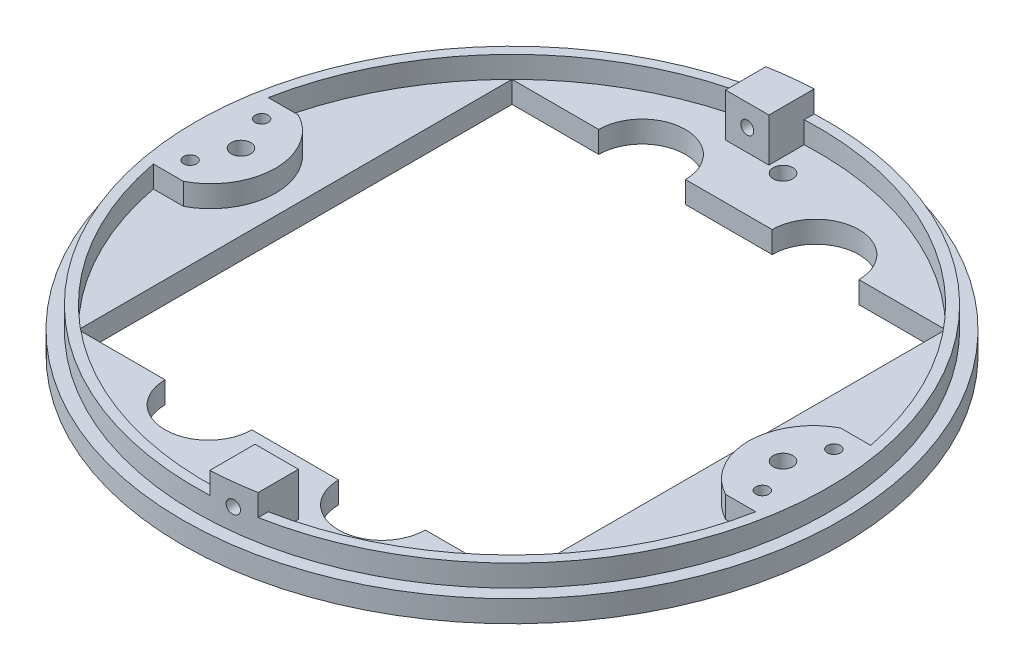
from build123d import *

# Parameters (mm, degrees)
SKETCH1_R           = 76
SKETCH1_W           = 100
SKETCH1_H           = 100
BOSS_EXTRUDE1_DEPTH = 5
SKETCH2_R           = 2.25
CUT_EXTRUDE1_DEPTH  = 10
SKETCH5_R           = 73
SKETCH5_R_2         = 70.710678119
BOSS_EXTRUDE3_DEPTH = 5
BOSS_EXTRUDE6_DEPTH = 10
CUT_EXTRUDE4_DEPTH  = 30
CUT_EXTRUDE5_DEPTH  = 70
BOSS_EXTRUDE7_DEPTH = 5
SKETCH14_R          = 1.5
CUT_EXTRUDE6_DEPTH  = 44
CUT_EXTRUDE7_DEPTH  = 30
SKETCH17_R          = 2.25
BOSS_EXTRUDE9_DEPTH = 5


with BuildPart() as part:
    # Sketch1 → Boss-Extrude1 (new body)
    with BuildSketch(Plane(origin=(0, 0, 0), x_dir=(1, 0, 0), z_dir=(0, 1, 0))):
        with Locations(Location((0, 0, 0), (0, 0, 270))):
            Circle(SKETCH1_R)
        Rectangle(SKETCH1_W, SKETCH1_H, mode=Mode.SUBTRACT)
    extrude(amount=BOSS_EXTRUDE1_DEPTH)

    # Sketch2 → Cut-Extrude1 (cut)
    with BuildSketch(Plane(origin=(0, 5, 0), x_dir=(1, 0, 0), z_dir=(0, 1, 0))):
        with Locations(Location((-62.5, 0, 0), (0, 0, 270))):
            Circle(SKETCH2_R)
        with Locations(Location((0, 62.5, 0), (0, 0, 270))):
            Circle(SKETCH2_R)
        with Locations(Location((62.5, 0, 0), (0, 0, 270))):
            Circle(SKETCH2_R)
        with Locations(Location((0, -62.5, 0), (0, 0, 270))):
            Circle(SKETCH2_R)
    extrude(amount=-CUT_EXTRUDE1_DEPTH, mode=Mode.SUBTRACT)

    # Sketch5 → Boss-Extrude3 (add)
    with BuildSketch(Plane(origin=(0, 5, 0), x_dir=(1, 0, 0), z_dir=(0, 1, 0))):
        with Locations(Location((0, 0, 0), (0, 0, 270))):
            Circle(SKETCH5_R)
        with Locations(Location((0, 0, 0), (0, 0, 135))):
            Circle(SKETCH5_R_2, mode=Mode.SUBTRACT)
    extrude(amount=BOSS_EXTRUDE3_DEPTH)

    # Sketch10 → Boss-Extrude6 (add)
    with BuildSketch(Plane(origin=(0, 5, 0), x_dir=(1, 0, 0), z_dir=(0, 1, 0))):
        with BuildLine():
            Line((3.25, -62.5), (3.25, -72.927618225))
            ThreePointArc((3.25, -72.927618225), (8.269673379, -72.530079982), (13.25, -71.787446674))
            Line((13.25, -71.787446674), (13.25, -62.5))
            Line((13.25, -62.5), (3.25, -62.5))
        make_face()
        with BuildLine():
            Line((-13.25, 62.5), (-3.25, 62.5))
            Line((-3.25, 62.5), (-3.25, 70.635950478))
            ThreePointArc((-3.25, 70.635950478), (-8.270990945, 70.225285395), (-13.25, 69.458170866))
            Line((-13.25, 69.458170866), (-13.25, 62.5))
        make_face()
        with BuildLine():
            ThreePointArc((-13.25, 69.458170866), (-8.270990945, 70.225285395), (-3.25, 70.635950478))
            Line((-3.25, 70.635950478), (-3.25, 72.927618225))
            ThreePointArc((-3.25, 72.927618225), (-8.269673379, 72.530079982), (-13.25, 71.787446674))
            Line((-13.25, 71.787446674), (-13.25, 69.458170866))
        make_face()
    extrude(amount=BOSS_EXTRUDE6_DEPTH)

    # Sketch11 → Cut-Extrude4 (cut)
    with BuildSketch(Plane.XY.offset(-62.5)):
        with BuildLine():
            ThreePointArc((-6.75, 10), (-7.189339828, 11.060660172), (-8.25, 11.5))
            Line((-8.25, 11.5), (-8.25, 8.5))
            ThreePointArc((-8.25, 8.5), (-7.189339828, 8.939339828), (-6.75, 10))
        make_face()
        with BuildLine():
            Line((-8.25, 8.5), (-8.25, 11.5))
            ThreePointArc((-8.25, 11.5), (-9.75, 10), (-8.25, 8.5))
        make_face()
    extrude(amount=-CUT_EXTRUDE4_DEPTH, mode=Mode.SUBTRACT)

    # Sketch12 → Cut-Extrude5 (cut)
    with BuildSketch(Plane(origin=(0, 0, 62.5), x_dir=(-1, 0, 0), z_dir=(0, 0, -1))):
        with BuildLine():
            ThreePointArc((-6.75, 10), (-7.189339828, 11.060660172), (-8.25, 11.5))
            Line((-8.25, 11.5), (-8.25, 8.5))
            ThreePointArc((-8.25, 8.5), (-7.189339828, 8.939339828), (-6.75, 10))
        make_face()
        with BuildLine():
            Line((-8.25, 8.5), (-8.25, 11.5))
            ThreePointArc((-8.25, 11.5), (-9.75, 10), (-8.25, 8.5))
        make_face()
    extrude(amount=-CUT_EXTRUDE5_DEPTH, mode=Mode.SUBTRACT)

    # Sketch13 → Boss-Extrude7 (add)
    with BuildSketch(Plane(origin=(0, 5, 0), x_dir=(1, 0, 0), z_dir=(0, 1, 0))):
        with BuildLine():
            Line((-62.5, -13.25), (-62.5, -3.25))
            Line((-62.5, -3.25), (-72.927618225, -3.25))
            ThreePointArc((-72.927618225, -3.25), (-72.530079982, -8.269673379), (-71.787446674, -13.25))
            Line((-71.787446674, -13.25), (-62.5, -13.25))
        make_face()
        with BuildLine():
            Line((-72.927618225, 3.25), (-62.5, 3.25))
            Line((-62.5, 3.25), (-62.5, 13.25))
            Line((-62.5, 13.25), (-71.787446674, 13.25))
            ThreePointArc((-71.787446674, 13.25), (-72.530079982, 8.269673379), (-72.927618225, 3.25))
        make_face()
        with BuildLine():
            Line((71.787446674, 13.25), (62.5, 13.25))
            Line((62.5, 13.25), (62.5, 3.25))
            Line((62.5, 3.25), (72.927618225, 3.25))
            ThreePointArc((72.927618225, 3.25), (72.530079982, 8.269673379), (71.787446674, 13.25))
        make_face()
        with BuildLine():
            Line((62.5, -3.25), (62.5, -13.25))
            Line((62.5, -13.25), (71.787446674, -13.25))
            ThreePointArc((71.787446674, -13.25), (72.530079982, -8.269673379), (72.927618225, -3.25))
            Line((72.927618225, -3.25), (62.5, -3.25))
        make_face()
    extrude(amount=BOSS_EXTRUDE7_DEPTH)

    # Sketch14 → Cut-Extrude6 (cut)
    with BuildSketch(Plane(origin=(0, 10, 0), x_dir=(1, 0, 0), z_dir=(0, 1, 0))):
        with BuildLine():
            ThreePointArc((-64.479085433, 8.25), (-64.918425261, 9.310660172), (-65.979085433, 9.75))
            Line((-65.979085433, 9.75), (-65.979085433, 6.75))
            ThreePointArc((-65.979085433, 6.75), (-64.918425261, 7.189339828), (-64.479085433, 8.25))
        make_face()
        with BuildLine():
            Line((-65.979085433, 6.75), (-65.979085433, 9.75))
            ThreePointArc((-65.979085433, 9.75), (-67.479085433, 8.25), (-65.979085433, 6.75))
        make_face()
        with BuildLine():
            ThreePointArc((-65.979085433, -6.75), (-67.479085433, -8.25), (-65.979085433, -9.75))
            Line((-65.979085433, -9.75), (-65.979085433, -6.75))
        make_face()
        with BuildLine():
            Line((-65.979085433, -6.75), (-65.979085433, -9.75))
            ThreePointArc((-65.979085433, -9.75), (-64.918425261, -9.310660172), (-64.479085433, -8.25))
            ThreePointArc((-64.479085433, -8.25), (-64.918425261, -7.189339828), (-65.979085433, -6.75))
        make_face()
        with Locations(Location((65.979085433, 8.25, 0), (0, 0, 270))):
            Circle(SKETCH14_R)
        with Locations(Location((65.979085433, -8.25, 0), (0, 0, 270))):
            Circle(SKETCH14_R)
    extrude(amount=-CUT_EXTRUDE6_DEPTH, mode=Mode.SUBTRACT)

    # Sketch16 → Cut-Extrude7 (cut)
    with BuildSketch(Plane(origin=(0, 5, 0), x_dir=(1, 0, 0), z_dir=(0, 1, 0))):
        with BuildLine():
            ThreePointArc((-30, -50), (-20, -60), (-10, -50))
            Line((-10, -50), (-30, -50))
        make_face()
        with BuildLine():
            Line((30, -50), (10, -50))
            ThreePointArc((10, -50), (20, -60), (30, -50))
        make_face()
        with BuildLine():
            Line((-30, 50), (-10, 50))
            ThreePointArc((-10, 50), (-20, 60), (-30, 50))
        make_face()
        with BuildLine():
            ThreePointArc((10, 50), (20, 60), (30, 50))
            Line((30, 50), (10, 50))
        make_face()
    extrude(amount=-CUT_EXTRUDE7_DEPTH, mode=Mode.SUBTRACT)

    # Sketch17 → Boss-Extrude9 (add)
    # profile 1 of 2: a face of its own
    with BuildSketch(Plane(origin=(0, 5, 0), x_dir=(1, 0, 0), z_dir=(0, 1, 0))):
        with BuildLine():
            Line((-62.5, -3.25), (-62.5, -13.25))
            ThreePointArc((-62.5, -13.25), (-54.514590429, 0), (-62.5, 13.25))
            Line((-62.5, 13.25), (-62.5, 3.25))
            Line((-62.5, 3.25), (-70.635950478, 3.25))
            ThreePointArc((-70.635950478, 3.25), (-70.710678119, 0), (-70.635950478, -3.25))
            Line((-70.635950478, -3.25), (-62.5, -3.25))
        make_face()
        with Locations(Location((-62.5, 0, 0), (0, 0, 270))):
            Circle(SKETCH17_R, mode=Mode.SUBTRACT)
    # profile 2 of 2: a face of its own
    with BuildSketch(Plane(origin=(0, 5, 0), x_dir=(1, 0, 0), z_dir=(0, 1, 0))):
        with BuildLine():
            Line((62.5, -3.25), (62.5, -13.25))
            ThreePointArc((62.5, -13.25), (54.514590429, 0), (62.5, 13.25))
            Line((62.5, 13.25), (62.5, 3.25))
            Line((62.5, 3.25), (70.635950478, 3.25))
            ThreePointArc((70.635950478, 3.25), (70.710678119, 0), (70.635950478, -3.25))
            Line((70.635950478, -3.25), (62.5, -3.25))
        make_face()
        with Locations(Location((62.5, 0, 0), (0, 0, 270))):
            Circle(SKETCH17_R, mode=Mode.SUBTRACT)
    extrude(amount=BOSS_EXTRUDE9_DEPTH)


solid = part.part
